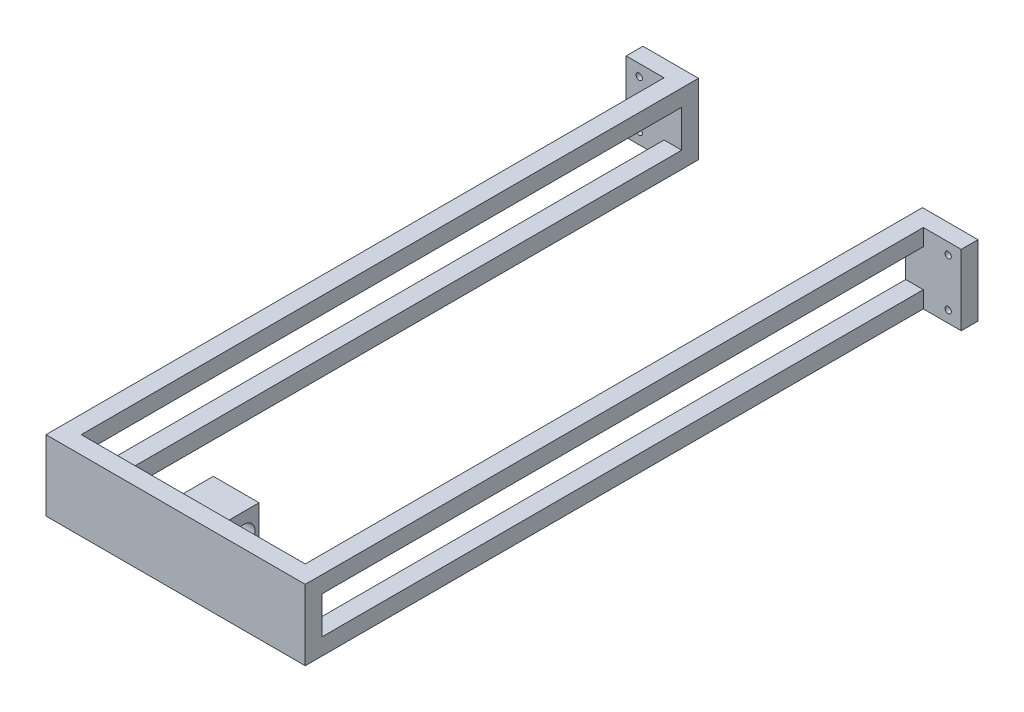
from build123d import *

# Parameters (mm, degrees)
SKETCH2_W             = 120.65
SKETCH2_H             = 25.4
BOSS_EXTRUDE2_DEPTH   = 228.6
F_4_40_TAPPED_HOLE2_D = 2.2606
SKETCH3_W             = 13.65
SKETCH3_H             = 222.560167774
CUT_EXTRUDE2_DEPTH    = 228.6
SKETCH9_W             = 216.560167774
SKETCH9_H             = 13.4
CUT_EXTRUDE3_DEPTH    = 228.6
SKETCH12_W            = 16.47911479
SKETCH12_H            = 16.039471942
BOSS_EXTRUDE4_DEPTH   = 15.81
SKETCH13_R            = 4.064
CUT_EXTRUDE4_DEPTH    = 21.81


with BuildPart() as part:
    # Sketch2 → Boss-Extrude2 (new body)
    with BuildSketch(Plane.XY):
        Rectangle(SKETCH2_W, SKETCH2_H)
    extrude(amount=BOSS_EXTRUDE2_DEPTH)

    # #4-40 Tapped Hole2 (through all)
    with Locations(Plane.XY.offset(228.6)):
        with Locations((-55.626, 8.5698965), (-55.626, -8.5698965), (55.626, 8.5698965), (55.626, -8.5698965)):
            Hole(F_4_40_TAPPED_HOLE2_D / 2)

    # Sketch3 → Cut-Extrude2 (cut)
    with BuildSketch(Plane.XZ.offset(12.7)):
        Polygon((-40.325, 6.039832226), (-40.325, 0), (40.325, 0), (40.325, 6.039832226), (40.325, 222.25), (-40.325, 222.25), align=None)
        with Locations((-53.5, 117.319916113)):
            Rectangle(SKETCH3_W, SKETCH3_H)
        with Locations((53.5, 117.319916113)):
            Rectangle(SKETCH3_W, SKETCH3_H)
    extrude(amount=-CUT_EXTRUDE2_DEPTH, mode=Mode.SUBTRACT)

    # Sketch9 → Cut-Extrude3 (cut)
    with BuildSketch(Plane.ZY.offset(46.675)):
        with Locations((114.319916113, 0)):
            Rectangle(SKETCH9_W, SKETCH9_H)
    extrude(amount=-CUT_EXTRUDE3_DEPTH, mode=Mode.SUBTRACT)

    # Sketch12 → Boss-Extrude4 (add)
    with BuildSketch(Plane(origin=(0, 0, 222.6), x_dir=(-1, 0, 0), z_dir=(0, 0, -1))):
        Rectangle(SKETCH12_W, SKETCH12_H)
    extrude(amount=BOSS_EXTRUDE4_DEPTH)

    # Sketch13 → Cut-Extrude4 (cut)
    with BuildSketch(Plane.ZY.offset(8.239557395)):
        with Locations((212.3276832, 0)):
            Circle(SKETCH13_R)
    extrude(amount=-CUT_EXTRUDE4_DEPTH, mode=Mode.SUBTRACT)


solid = part.part
